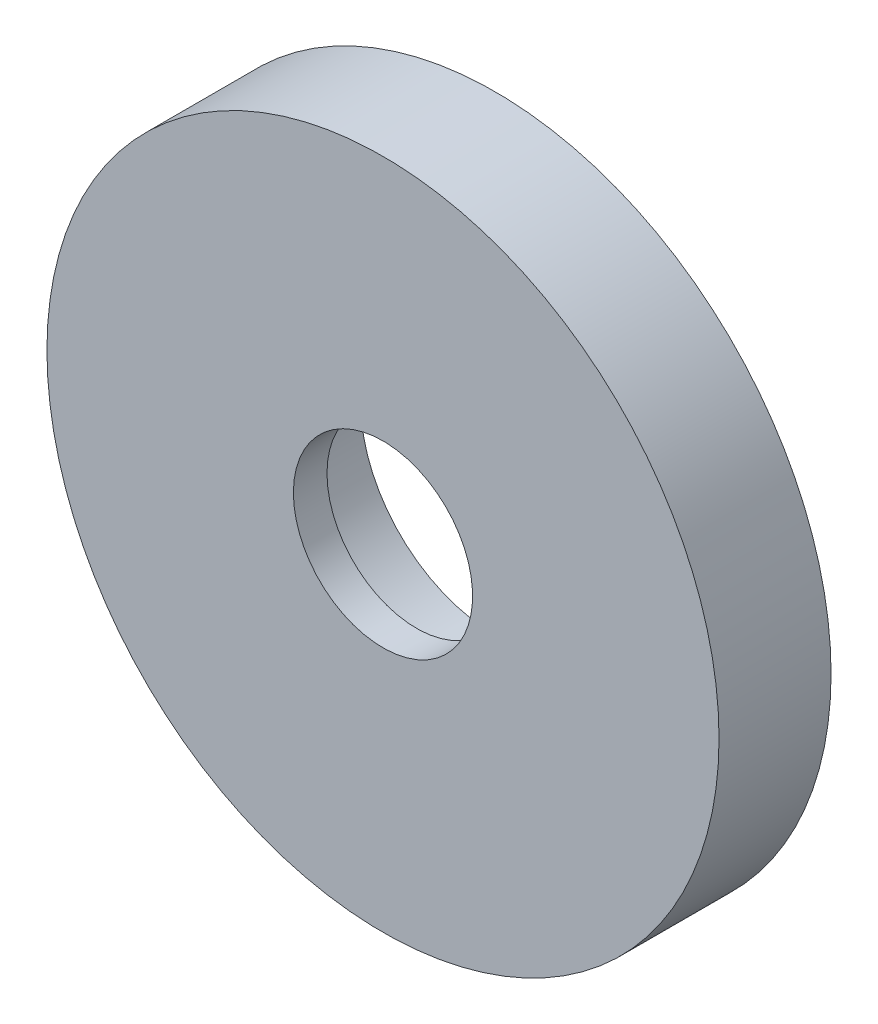
from build123d import *

# Parameters (mm, degrees)
SKETCH1_R           = 15
BOSS_EXTRUDE1_DEPTH = 5
CUT_EXTRUDE1_DEPTH  = 2.75
CIRPATTERN1_COUNT   = 4
SKETCH2_R           = 4
CUT_EXTRUDE2_DEPTH  = 22.794494718
SKETCH2_3_R         = 6
SKETCH2_3_R_2       = 4
CUT_EXTRUDE3_DEPTH  = 3.5


with BuildPart() as part:
    # Sketch1 → Boss-Extrude1 (new body)
    with BuildSketch(Plane.XY):
        Circle(SKETCH1_R)
    extrude(amount=BOSS_EXTRUDE1_DEPTH)

    # Sketch1<3> → Cut-Extrude1 (cut)
    with BuildSketch(Plane.XY):
        with BuildLine():
            ThreePointArc((-5.625, 10.075), (-5.441941738, 9.633058262), (-5, 9.45))
            Line((-5, 9.45), (5, 9.45))
            ThreePointArc((5, 9.45), (5.441941738, 9.633058262), (5.625, 10.075))
            Line((5.625, 10.075), (5.625, 11.864469015))
            ThreePointArc((5.625, 11.864469015), (5.520732191, 12.210103193), (5.242718447, 12.440414112))
            ThreePointArc((5.242718447, 12.440414112), (4.087012875, 12.866480706), (2.897283889, 13.185436893))
            ThreePointArc((2.897283889, 13.185436893), (2.83061126, 13.196348557), (2.763150376, 13.2))
            Line((2.763150376, 13.2), (-2.763150376, 13.2))
            ThreePointArc((-2.763150376, 13.2), (-2.83061126, 13.196348557), (-2.897283889, 13.185436893))
            ThreePointArc((-2.897283889, 13.185436893), (-4.087012875, 12.866480706), (-5.242718447, 12.440414112))
            ThreePointArc((-5.242718447, 12.440414112), (-5.520732191, 12.210103193), (-5.625, 11.864469015))
            Line((-5.625, 11.864469015), (-5.625, 10.075))
        make_face()
    cut_extrude1 = extrude(amount=CUT_EXTRUDE1_DEPTH, mode=Mode.SUBTRACT)

    # CirPattern1: Cut-Extrude1 ×4 about axis
    cirpattern1_axis = Axis((0, 0, 5.25), (0, 0, -1))
    for i in range(1, CIRPATTERN1_COUNT):
        add(cut_extrude1.rotate(cirpattern1_axis, i * 360 / CIRPATTERN1_COUNT), mode=Mode.SUBTRACT)

    # Sketch2 → Cut-Extrude2 (cut, through all)
    with BuildSketch(Plane(origin=(0, 0, 0), x_dir=(-1, 0, 0), z_dir=(0, 0, -1))):
        Circle(SKETCH2_R)
    extrude(amount=-CUT_EXTRUDE2_DEPTH, mode=Mode.SUBTRACT)

    # Sketch2<3> → Cut-Extrude3 (cut)
    with BuildSketch(Plane(origin=(0, 0, 0), x_dir=(-1, 0, 0), z_dir=(0, 0, -1))):
        Circle(SKETCH2_3_R)
        Circle(SKETCH2_3_R_2, mode=Mode.SUBTRACT)
    extrude(amount=-CUT_EXTRUDE3_DEPTH, mode=Mode.SUBTRACT)


solid = part.part
